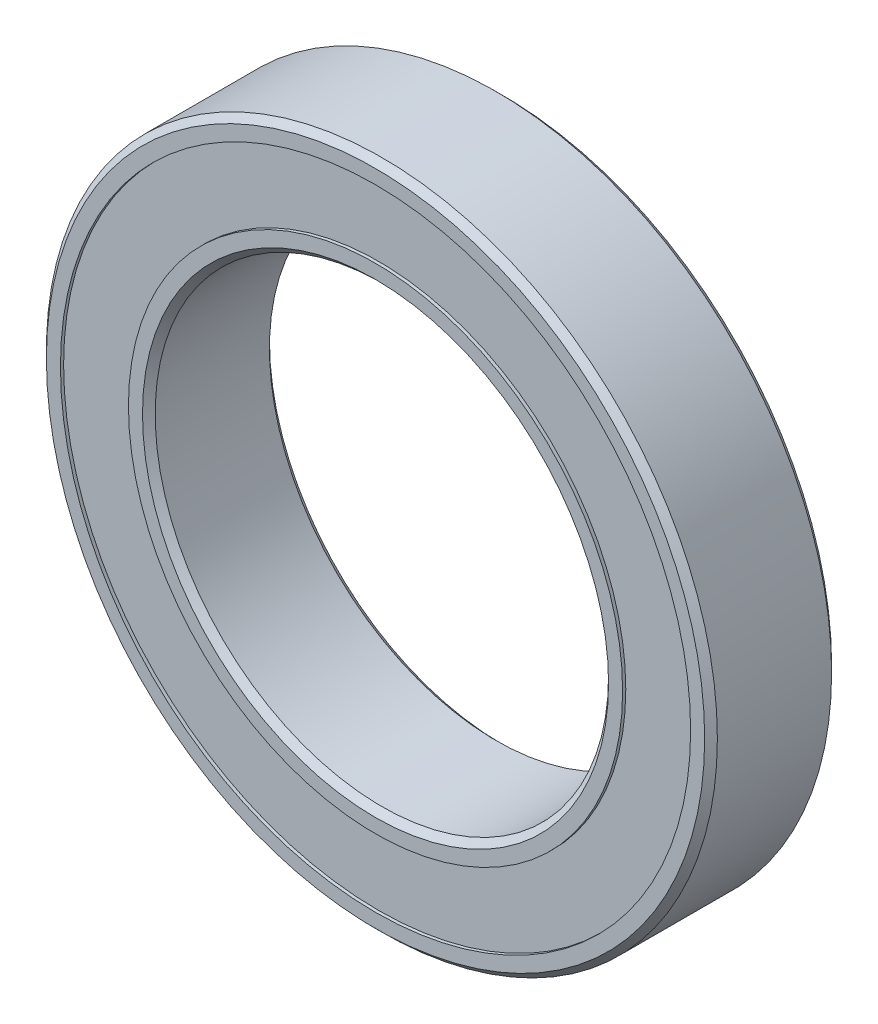
from build123d import *

# Parameters (mm, degrees)
CIRPATTERN1_COUNT = 12
SKETCH5_W         = 0.88873686
SKETCH5_H         = 3.75


with BuildPart() as part:
    # Sketch3 → Revolve1 (revolve)
    with BuildSketch(Plane(origin=(0, 0, 0), x_dir=(0, 0, -1), z_dir=(1, 0, 0)), mode=Mode.PRIVATE) as revolve1_sk:
        with BuildLine():
            Line((-3.5, 18.15), (-3.5, 17.375))
            Line((-3.5, 17.375), (-1.555555556, 17.375))
            ThreePointArc((-1.555555556, 17.375), (0, 17.93626314), (1.555555556, 17.375))
            Line((1.555555556, 17.375), (3.5, 17.375))
            Line((3.5, 17.375), (3.5, 18.15))
            Line((3.5, 18.15), (3.15, 18.5))
            Line((3.15, 18.5), (-3.15, 18.5))
            Line((-3.15, 18.5), (-3.5, 18.15))
        make_face()
        with BuildLine():
            Line((-3.5, 12.85), (-3.5, 13.625))
            Line((-3.5, 13.625), (-1.555555556, 13.625))
            ThreePointArc((-1.555555556, 13.625), (0, 13.06373686), (1.555555556, 13.625))
            Line((1.555555556, 13.625), (3.5, 13.625))
            Line((3.5, 13.625), (3.5, 12.85))
            Line((3.5, 12.85), (3.15, 12.5))
            Line((3.15, 12.5), (-3.15, 12.5))
            Line((-3.15, 12.5), (-3.5, 12.85))
        make_face()
    revolve(revolve1_sk.sketch.rotate(Axis((0, 0, 3.5), (0, 0, -1)), 90), axis=Axis((0, 0, 3.5), (0, 0, -1)))


with BuildPart() as body_2:
    # Sketch4 → Revolve2 (revolve)
    with BuildSketch(Plane(origin=(0, 0, 0), x_dir=(0, 0, -1), z_dir=(1, 0, 0))):
        with BuildLine():
            Line((-2.43626314, 15.5), (2.43626314, 15.5))
            ThreePointArc((2.43626314, 15.5), (0, 17.93626314), (-2.43626314, 15.5))
        make_face()
    revolve(axis=Axis((0, 15.5, 2.43626314), (0, 0, -1)))


with BuildPart() as cirpattern1_1:
    # CirPattern1: pattern copy
    add(body_2.part.rotate(Axis((0, 0, 0), (0, 0, 1)), 1 * 360 / CIRPATTERN1_COUNT))


with BuildPart() as cirpattern1_2:
    # CirPattern1: pattern copy
    add(body_2.part.rotate(Axis((0, 0, 0), (0, 0, 1)), 2 * 360 / CIRPATTERN1_COUNT))


with BuildPart() as cirpattern1_3:
    # CirPattern1: pattern copy
    add(body_2.part.rotate(Axis((0, 0, 0), (0, 0, 1)), 3 * 360 / CIRPATTERN1_COUNT))


with BuildPart() as cirpattern1_4:
    # CirPattern1: pattern copy
    add(body_2.part.rotate(Axis((0, 0, 0), (0, 0, 1)), 4 * 360 / CIRPATTERN1_COUNT))


with BuildPart() as cirpattern1_5:
    # CirPattern1: pattern copy
    add(body_2.part.rotate(Axis((0, 0, 0), (0, 0, 1)), 5 * 360 / CIRPATTERN1_COUNT))


with BuildPart() as cirpattern1_6:
    # CirPattern1: pattern copy
    add(body_2.part.rotate(Axis((0, 0, 0), (0, 0, 1)), 6 * 360 / CIRPATTERN1_COUNT))


with BuildPart() as cirpattern1_7:
    # CirPattern1: pattern copy
    add(body_2.part.rotate(Axis((0, 0, 0), (0, 0, 1)), 7 * 360 / CIRPATTERN1_COUNT))


with BuildPart() as cirpattern1_8:
    # CirPattern1: pattern copy
    add(body_2.part.rotate(Axis((0, 0, 0), (0, 0, 1)), 8 * 360 / CIRPATTERN1_COUNT))


with BuildPart() as cirpattern1_9:
    # CirPattern1: pattern copy
    add(body_2.part.rotate(Axis((0, 0, 0), (0, 0, 1)), 9 * 360 / CIRPATTERN1_COUNT))


with BuildPart() as cirpattern1_10:
    # CirPattern1: pattern copy
    add(body_2.part.rotate(Axis((0, 0, 0), (0, 0, 1)), 10 * 360 / CIRPATTERN1_COUNT))


with BuildPart() as cirpattern1_11:
    # CirPattern1: pattern copy
    add(body_2.part.rotate(Axis((0, 0, 0), (0, 0, 1)), 11 * 360 / CIRPATTERN1_COUNT))


with BuildPart() as body_14:
    # Sketch5 → Revolve3 (revolve)
    with BuildSketch(Plane(origin=(0, 0, 0), x_dir=(0, 0, -1), z_dir=(1, 0, 0)), mode=Mode.PRIVATE) as revolve3_sk:
        with Locations((-2.88063157, 15.5)):
            Rectangle(SKETCH5_W, SKETCH5_H)
        with Locations((2.88063157, 15.5)):
            Rectangle(SKETCH5_W, SKETCH5_H)
    revolve(revolve3_sk.sketch.rotate(Axis((0, 0, 3.5), (0, 0, -1)), 90), axis=Axis((0, 0, 3.5), (0, 0, -1)))


solid = Compound([part.part, body_2.part, cirpattern1_1.part, cirpattern1_2.part, cirpattern1_3.part, cirpattern1_4.part, cirpattern1_5.part, cirpattern1_6.part, cirpattern1_7.part, cirpattern1_8.part, cirpattern1_9.part, cirpattern1_10.part, cirpattern1_11.part, body_14.part])
